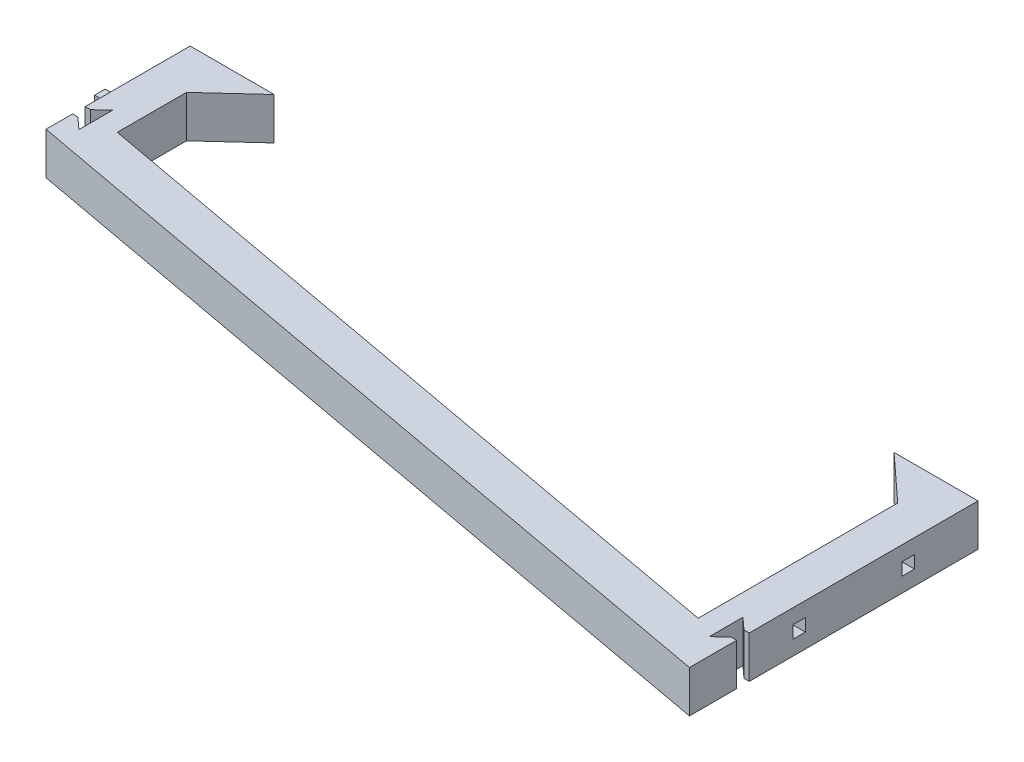
from build123d import *

# Parameters (mm, degrees)
P_IDAT_VYSUNUT_M1_DEPTH  = 8
ODEBRAT_VYSUNUT_M1_DEPTH = 161.106285011
SKICA6_W                 = 16
SKICA6_H                 = 8
P_IDAT_VYSUNUT_M3_DEPTH  = 8
ODEBRAT_VYSUNUT_M4_DEPTH = 161.106285011
SKICA4_W                 = 2.4
SKICA4_H                 = 2.4
ODEBRAT_VYSUNUT_M2_DEPTH = 4.4
SKICA5_W                 = 2
SKICA5_H                 = 2
P_IDAT_VYSUNUT_M2_DEPTH  = 4
ODEBRAT_VYSUNUT_M5_DEPTH = 164.863426365
SKICA12_R                = 2.2
ODEBRAT_VYSUNUT_M7_DEPTH = 9.4


with BuildPart() as part:
    # Skica1 → Přidat vysunutím1 (new body)
    with BuildSketch(Plane(origin=(0, 0, 0), x_dir=(1, 0, 0), z_dir=(0, 1, 0))):
        Polygon((0, 0), (0, -55), (-150.15, -27.472114866), (-150.15, 0), (-142.85, 0), (-142.85, -21.185463454), (-7.3, -46.036644473), (-7.3, 0), align=None)
    extrude(amount=P_IDAT_VYSUNUT_M1_DEPTH)

    # Skica3 → Odebrat vysunutím1 (cut, through all)
    with BuildSketch(Plane(origin=(0, 8, 0), x_dir=(1, 0, 0), z_dir=(0, 1, 0))):
        Polygon((-1, -43.6), (-3.2, -41.6), (-3.2, -48), (-1, -46), (0, -46), (0, -43.6), align=None)
    extrude(amount=-ODEBRAT_VYSUNUT_M1_DEPTH, mode=Mode.SUBTRACT)

    # Skica6 → Přidat vysunutím3 (add)
    with BuildSketch(Plane(origin=(0, 8, 0), x_dir=(1, 0, 0), z_dir=(0, 1, 0))):
        with Locations((-142.15, -4)):
            Rectangle(SKICA6_W, SKICA6_H)
        with Locations((-8, -4)):
            Rectangle(SKICA6_W, SKICA6_H)
    extrude(amount=-P_IDAT_VYSUNUT_M3_DEPTH)

    # Skica9 → Odebrat vysunutím4 (cut, through all)
    with BuildSketch(Plane.XZ):
        Polygon((-142.85, 8), (-134.15, 8), (-134.15, 0), align=None)
        Polygon((-16, 8), (-7.3, 8), (-16, 0), align=None)
    extrude(amount=-ODEBRAT_VYSUNUT_M4_DEPTH, mode=Mode.SUBTRACT)

    # Skica4 → Odebrat vysunutím2 (cut)
    with BuildSketch(Plane(origin=(0, 0, 0), x_dir=(0, 0, -1), z_dir=(1, 0, 0))):
        with Locations((-34.1, 4)):
            Rectangle(SKICA4_W, SKICA4_H)
        with Locations((-13.3, 4)):
            Rectangle(SKICA4_W, SKICA4_H)
    extrude(amount=-ODEBRAT_VYSUNUT_M2_DEPTH, mode=Mode.SUBTRACT)

    # Skica5 → Přidat vysunutím2 (add)
    with BuildSketch(Plane.ZY.offset(150.15)):
        with Locations((13.2, 4)):
            Rectangle(SKICA5_W, SKICA5_H)
    extrude(amount=P_IDAT_VYSUNUT_M2_DEPTH)

    # Skica10 → Odebrat vysunutím5 (cut, through all)
    with BuildSketch(Plane(origin=(0, 8, 0), x_dir=(1, 0, 0), z_dir=(0, 1, 0))):
        Polygon((-150.15, -22.4), (-149.15, -22.4), (-146.95, -24.4), (-146.95, -18), (-149.15, -20), (-150.15, -20), align=None)
    extrude(amount=-ODEBRAT_VYSUNUT_M5_DEPTH, mode=Mode.SUBTRACT)

    # Skica12 → Odebrat vysunutím7 (cut)
    with BuildSketch(Plane(origin=(0, 0, 0), x_dir=(-1, 0, 0), z_dir=(0, 0, -1))):
        with Locations((3.65, 4)):
            Circle(SKICA12_R)
        with Locations((146.5, 4)):
            Circle(SKICA12_R)
    extrude(amount=-ODEBRAT_VYSUNUT_M7_DEPTH, mode=Mode.SUBTRACT)


solid = part.part
